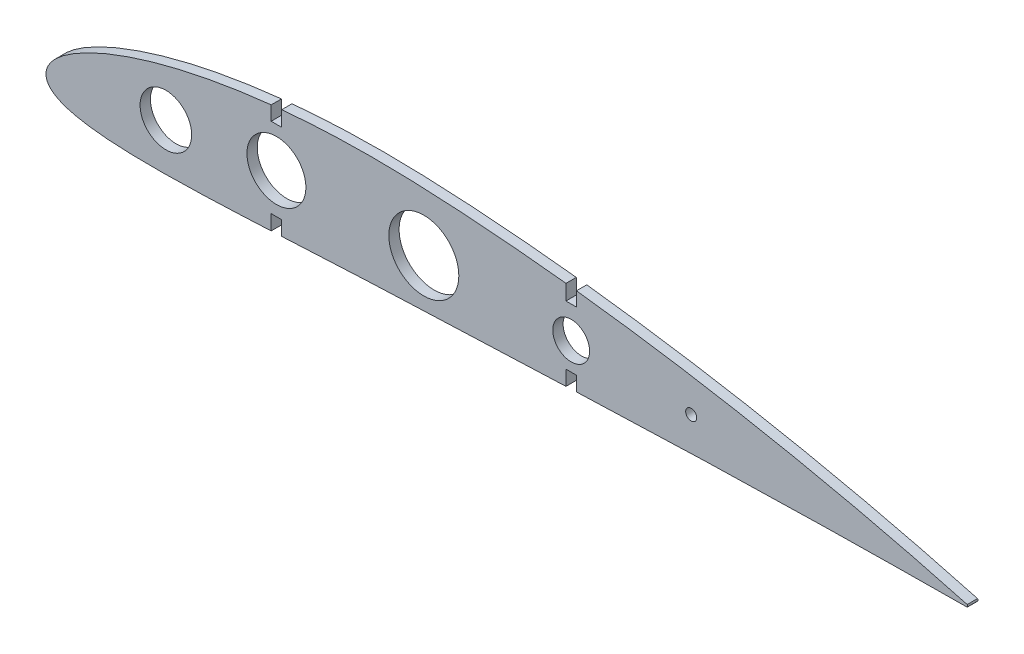
from build123d import *

# Parameters (mm, degrees)
SKETCH_1_R      = 7
SKETCH_1_R_2    = 8
SKETCH_1_R_3    = 9.5
SKETCH_1_R_4    = 5
SKETCH_1_R_5    = 1.5
EXTRUDE_1_DEPTH = 1.4


with BuildPart() as part:
    # Эскиз1 → Бобышка-Вытянуть1 (new, symmetric)
    # profile 1 of 2: a face of its own
    with BuildSketch(Plane.XY):
        with BuildLine():
            Line((63.957619318, 19.450139662), (61.107619318, 19.450139662))
            Line((61.107619318, 19.450139662), (61.107619318, 23.303137173))
            add(Edge.make_bspline(
                [(61.107619318, 23.303137173), (59.917945614, 23.176751945), (56.739740439, 22.81448979), (51.605762688, 22.119065522), (45.744400311, 21.156564432), (39.995857594, 20.03537139), (34.397919842, 18.756316235), (29.010382103, 17.327615608), (23.925798408, 15.771864922), (19.27067884, 14.134269435), (15.179098391, 12.483335438), (11.74047579, 10.895610996), (8.959371869, 9.429577366), (6.76089118, 8.1086032), (5.033709748, 6.924638056), (3.671694933, 5.854229665), (2.592101123, 4.871305369), (1.738175668, 3.952595744), (1.06987083, 3.080946374), (0.57164541, 2.241622103), (0.215773899, 1.430785398), (0.102255581, 0.883241695), (0.047975, 0.621425001)],
                knots=[0.740090669, 0.740090669, 0.740090669, 0.740090669, 0.7539832, 0.77723469, 0.800246382, 0.822950709, 0.845237155, 0.866915896, 0.887662335, 0.906968281, 0.924203157, 0.938878975, 0.950931611, 0.960693484, 0.968646729, 0.975232933, 0.980794744, 0.985583761, 0.989781539, 0.993521313, 0.996902113, 1, 1, 1, 1], degree=3))
            add(Edge.make_bspline(
                [(0.047975, 0.621425001), (0.02271382, 0.373490086), (-0.027820789, -0.122499974), (0.077991212, -0.884434589), (0.34969565, -1.63883807), (0.814331135, -2.365068923), (1.46348078, -3.039275244), (2.290973016, -3.660999469), (3.30592875, -4.23577962), (4.535255619, -4.773674143), (6.029745688, -5.282192164), (7.868981215, -5.765316676), (10.168831391, -6.221716592), (13.075438188, -6.63961873), (16.728115362, -6.992956737), (21.189952096, -7.247345144), (26.399984415, -7.376638848), (32.197398564, -7.376256913), (38.397806759, -7.261436579), (44.857621768, -7.056641358), (51.486543096, -6.786453532), (56.920566709, -6.533358441), (60.139839208, -6.376114839), (61.107619318, -6.32836923)],
                knots=[0, 0, 0, 0, 0.002941446, 0.005884319, 0.00901613, 0.012364547, 0.016007934, 0.020036845, 0.024573728, 0.029783835, 0.03589701, 0.04324044, 0.052275965, 0.063634589, 0.077983176, 0.095698161, 0.116520086, 0.13966073, 0.16431217, 0.18991889, 0.216157201, 0.242837762, 0.254306514, 0.254306514, 0.254306514, 0.254306514], degree=3))
            Line((61.107619318, -6.32836923), (61.107619318, -2.257745247))
            Line((61.107619318, -2.257745247), (63.957619318, -2.257745247))
            Line((63.957619318, -2.257745247), (63.957619318, -6.186566126))
            add(Edge.make_bspline(
                [(63.957619318, -6.186566126), (64.317823095, -6.168514758), (66.969747676, -6.035316313), (71.910772709, -5.784005174), (78.771375576, -5.439680449), (85.610498609, -5.110951246), (92.432107589, -4.804953317), (99.25503119, -4.531981644), (106.097378404, -4.278274658), (112.96921168, -4.00308991), (119.864404254, -3.723176166), (126.773860473, -3.440067276), (133.855552455, -3.151608468), (138.633361552, -2.960411351), (141.107619318, -2.86287629)],
                knots=[0.265564796, 0.265564796, 0.265564796, 0.265564796, 0.269833583, 0.296993022, 0.324123272, 0.351139107, 0.378035509, 0.404946016, 0.431960837, 0.459078395, 0.4863474, 0.51364083, 0.540928595, 0.570237104, 0.570237104, 0.570237104, 0.570237104], degree=3))
            Line((141.107619318, -2.86287629), (141.107619318, 1.193130543))
            Line((141.107619318, 1.193130543), (143.957619318, 1.193130543))
            Line((143.957619318, 1.193130543), (143.957619318, -2.751209627))
            add(Edge.make_bspline(
                [(143.957619318, -2.751209627), (145.13020609, -2.705557458), (148.596084852, -2.571725453), (154.352602411, -2.355626415), (161.225044134, -2.109369921), (168.090869746, -1.876634074), (172.712313278, -1.729793129), (175.045239361, -1.65837681), (175.091334091, -1.656966802)],
                knots=[0.581490104, 0.581490104, 0.581490104, 0.581490104, 0.595379569, 0.622543445, 0.64967326, 0.676775201, 0.703855228, 0.704401069, 0.704401069, 0.704401069, 0.704401069], degree=3))
            ThreePointArc((175.091334091, -1.656966802), (165.940456932, 7.493910357), (175.091334091, 16.644787515))
            add(Edge.make_bspline(
                [(175.091334091, 16.644787515), (174.212389388, 16.789012775), (171.154404183, 17.284960287), (165.914317095, 18.099827841), (159.368680729, 19.054501815), (152.821805128, 19.944885603), (147.683892721, 20.591912914), (144.728786809, 20.943344409), (143.957619318, 21.033629847)],
                knots=[0.296903142, 0.296903142, 0.296903142, 0.296903142, 0.30724642, 0.332878042, 0.358484538, 0.384061186, 0.409602822, 0.418619192, 0.418619192, 0.418619192, 0.418619192], degree=3))
            Line((143.957619318, 21.033629847), (143.957619318, 17.19883932))
            Line((143.957619318, 17.19883932), (141.107619318, 17.19883932))
            Line((141.107619318, 17.19883932), (141.107619318, 21.360787161))
            add(Edge.make_bspline(
                [(141.107619318, 21.360787161), (140.647203073, 21.412583326), (138.008124909, 21.706530989), (133.19183673, 22.212004255), (126.658683026, 22.825721434), (120.136770918, 23.363973271), (113.62856714, 23.824677329), (107.152732037, 24.200242598), (100.741095693, 24.498399513), (94.411752715, 24.686649771), (88.155917993, 24.740095652), (81.949043055, 24.658849145), (75.780520591, 24.441013809), (69.785413798, 24.089605746), (65.850842722, 23.766532071), (63.957619318, 23.588464287)],
                knots=[0.429723551, 0.429723551, 0.429723551, 0.429723551, 0.435103874, 0.460559416, 0.485959195, 0.51130307, 0.536551515, 0.561723366, 0.586628867, 0.611085431, 0.6352512, 0.659272176, 0.683163753, 0.706922144, 0.729003809, 0.729003809, 0.729003809, 0.729003809], degree=3))
            Line((63.957619318, 23.588464287), (63.957619318, 19.450139662))
        make_face()
        with Locations((32.532619318, 5.448144701)):
            Circle(SKETCH_1_R, mode=Mode.SUBTRACT)
        with Locations((62.532619318, 8.596197208)):
            Circle(SKETCH_1_R_2, mode=Mode.SUBTRACT)
        with Locations((102.532619318, 8.596197208)):
            Circle(SKETCH_1_R_3, mode=Mode.SUBTRACT)
        with Locations((142.532619318, 8.596197208)):
            Circle(SKETCH_1_R_4, mode=Mode.SUBTRACT)
    # profile 2 of 2: a face of its own
    with BuildSketch(Plane.XY):
        with BuildLine():
            add(Edge.make_bspline(
                [(250, 0.315), (249.15566774, 0.545019818), (246.720175698, 1.208516243), (242.391332083, 2.358339053), (236.849761204, 3.787625364), (230.779918279, 5.298008837), (224.455917947, 6.812866028), (218.030543496, 8.291610632), (211.562405045, 9.719735057), (205.072411509, 11.092374932), (198.567970913, 12.407850726), (192.052369914, 13.665297924), (185.527619973, 14.864093303), (179.872800983, 15.850364437), (176.392239334, 16.431323122), (175.091334091, 16.644787515)],
                knots=[0, 0, 0, 0, 0.0101622, 0.029313053, 0.052011605, 0.076619468, 0.101948061, 0.127526132, 0.153184131, 0.178867888, 0.204557903, 0.230245712, 0.255925967, 0.281594302, 0.296903142, 0.296903142, 0.296903142, 0.296903142], degree=3))
            ThreePointArc((175.091334091, 16.644787515), (165.940456932, 7.493910357), (175.091334091, -1.656966802))
            add(Edge.make_bspline(
                [(175.091334091, -1.656966802), (177.330680613, -1.588466601), (181.854695323, -1.455127256), (188.663234462, -1.270383377), (195.516645168, -1.101112884), (202.369532894, -0.948617189), (211.49919029, -0.767742353), (220.603098666, -0.619939742), (229.617630172, -0.50292618), (236.087353854, -0.431514192), (241.980776913, -0.376520461), (246.558970011, -0.339535886), (249.120490965, -0.321271242), (250, -0.315)],
                knots=[0.704401069, 0.704401069, 0.704401069, 0.704401069, 0.730918775, 0.757971338, 0.785017763, 0.812061651, 0.839103366, 0.893099152, 0.919831065, 0.945809917, 0.969680601, 0.989589706, 1, 1, 1, 1], degree=3))
            ThreePointArc((250, -0.315), (250.130477272, 0), (250, 0.315))
        make_face()
        with Locations((175.091334091, 7.493910357)):
            Circle(SKETCH_1_R_5, mode=Mode.SUBTRACT)
    extrude(amount=EXTRUDE_1_DEPTH, both=True)


solid = part.part
